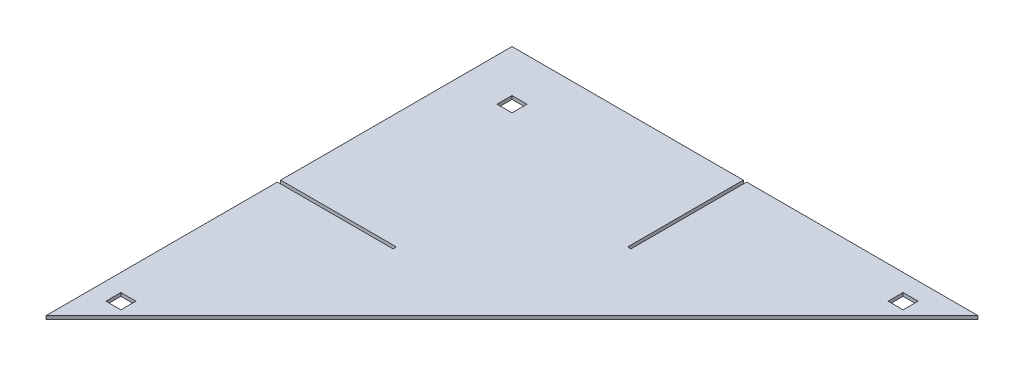
from build123d import *

# Parameters (mm, degrees)
SKETCH1_W           = 4.5
SKETCH1_H           = 4.5
BOSS_EXTRUDE3_DEPTH = 1


with BuildPart() as part:
    # Sketch1 → Boss-Extrude3 (new body)
    with BuildSketch(Plane(origin=(0, 0, 0), x_dir=(1, 0, 0), z_dir=(0, 1, 0))):
        Polygon((122.038308787, 26.301002263), (52.538308787, 26.301002263), (52.538308787, -8.448997737), (51.538308787, -8.448997737), (51.538308787, 26.301002263), (-17.961691213, 26.301002263), (-17.961691213, -43.198997737), (16.788308787, -43.198997737), (16.788308787, -44.198997737), (-17.961691213, -44.198997737), (-17.961691213, -113.698997737), align=None)
        with Locations((-2.961691213, 11.301002263)):
            Rectangle(SKETCH1_W, SKETCH1_H, mode=Mode.SUBTRACT)
        with Locations((107.038308787, 18.801002263)):
            Rectangle(SKETCH1_W, SKETCH1_H, mode=Mode.SUBTRACT)
        with Locations((-10.461691213, -98.698997737)):
            Rectangle(SKETCH1_W, SKETCH1_H, mode=Mode.SUBTRACT)
    extrude(amount=BOSS_EXTRUDE3_DEPTH)


solid = part.part
